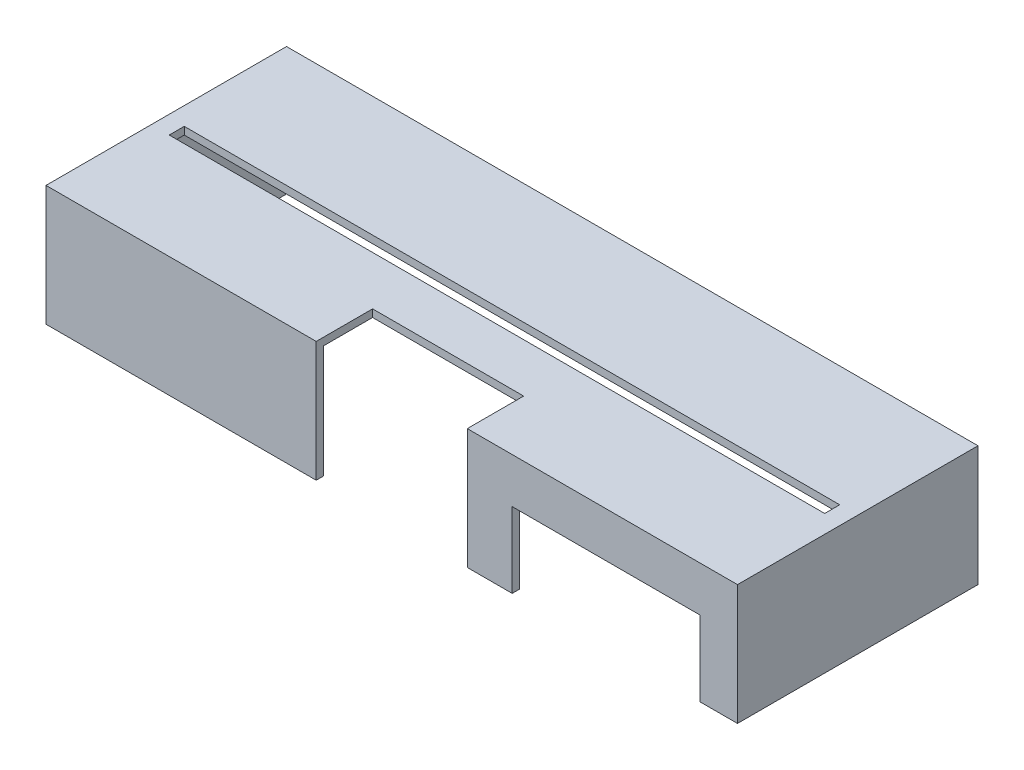
from build123d import *

# Parameters (mm, degrees)
SKETCH1_W                       = 184
SKETCH1_H                       = 64
SKETCH1_W_2                     = 180
SKETCH1_H_2                     = 60
EXTRUDE_THIN1_DEPTH             = 30
SKETCH3_W                       = 184
SKETCH3_H                       = 64
BOSS_EXTRUDE1_DEPTH             = 2
SKETCH4_W                       = 174.419493498
SKETCH4_H                       = 4
CUT_EXTRUDE1_DEPTH              = 5
SKETCH5_W                       = 40.195784268
SKETCH5_H                       = 59.069599678
CUT_EXTRUDE2_DEPTH              = 15
SKETCH6_W                       = 44.195784268
SKETCH6_H                       = 67.776893145
SKETCH6_W_2                     = 40.195784268
SKETCH6_H_2                     = 63.776893145
EXTRUDE_THIN2_DEPTH             = 35
EXTRUDE_THIN2_DIRECTION_2_REACH = 118.55
SKETCH7_W                       = 128.018506196
SKETCH7_H                       = 58.604777903
CUT_EXTRUDE3_DEPTH              = 85
SKETCH8_W                       = 13
SKETCH8_H                       = 30
CUT_EXTRUDE4_DEPTH              = 85
SKETCH9_W                       = 44.195784268
SKETCH9_H                       = 65.776893145
BOSS_EXTRUDE2_DEPTH             = 2
SKETCH13_W                      = 20.06
SKETCH13_H                      = 40.06
CUT_EXTRUDE6_DEPTH              = 10
SKETCH18_R                      = 2.03
CUT_EXTRUDE8_DEPTH              = 10
SKETCH19_W                      = 50
SKETCH19_H                      = 40
CUT_EXTRUDE9_DEPTH              = 10
SKETCH20_R                      = 2.03
CUT_EXTRUDE10_DEPTH             = 10
SKETCH21_W                      = 37
SKETCH21_H                      = 32
CUT_EXTRUDE11_DEPTH             = 217


with BuildPart() as part:
    # Sketch1 → Extrude-Thin1 (new body)
    with BuildSketch(Plane(origin=(0, 0, 0), x_dir=(1, 0, 0), z_dir=(0, 1, 0))):
        Rectangle(SKETCH1_W, SKETCH1_H)
        Rectangle(SKETCH1_W_2, SKETCH1_H_2, mode=Mode.SUBTRACT)
    extrude(amount=EXTRUDE_THIN1_DEPTH)

    # Sketch3 → Boss-Extrude1 (add)
    with BuildSketch(Plane(origin=(0, 30, 0), x_dir=(1, 0, 0), z_dir=(0, 1, 0))):
        Rectangle(SKETCH3_W, SKETCH3_H)
    extrude(amount=BOSS_EXTRUDE1_DEPTH)

    # Sketch4 → Cut-Extrude1 (cut)
    with BuildSketch(Plane(origin=(0, 32, 0), x_dir=(1, 0, 0), z_dir=(0, 1, 0))):
        with Locations((0, -2)):
            Rectangle(SKETCH4_W, SKETCH4_H)
    extrude(amount=-CUT_EXTRUDE1_DEPTH, mode=Mode.SUBTRACT)

    # Sketch5 → Cut-Extrude2 (cut)
    with BuildSketch(Plane.XY.offset(32)):
        with Locations((0, 16)):
            Rectangle(SKETCH5_W, SKETCH5_H)
    extrude(amount=-CUT_EXTRUDE2_DEPTH, mode=Mode.SUBTRACT)

    # Sketch6 → Extrude-Thin2 (add)
    with BuildSketch(Plane.XY.offset(32)):
        with Locations((0, 31.888446573)):
            Rectangle(SKETCH6_W, SKETCH6_H)
        with Locations((0, 31.888446573)):
            Rectangle(SKETCH6_W_2, SKETCH6_H_2, mode=Mode.SUBTRACT)
    extrude(amount=EXTRUDE_THIN2_DEPTH)

    # Extrude-Thin2 direction 2: up to this face of the body (flat: up to its plane)
    extrude_thin2_direction_2_end = Plane(part.part.faces().sort_by_distance((0, 31, 17))[0])
    # Sketch6 → Extrude-Thin2 direction 2 (add, up to the picked face)
    with BuildSketch(Plane.XY.offset(32), mode=Mode.PRIVATE) as extrude_thin2_direction_2_sk1:
        with Locations((0, 31.888446573)):
            Rectangle(SKETCH6_W, SKETCH6_H)
        with Locations((0, 31.888446573)):
            Rectangle(SKETCH6_W_2, SKETCH6_H_2, mode=Mode.SUBTRACT)
    extrude_thin2_direction_2_tool1 = split(extrude(extrude_thin2_direction_2_sk1.sketch, amount=-EXTRUDE_THIN2_DIRECTION_2_REACH, mode=Mode.PRIVATE), bisect_by=extrude_thin2_direction_2_end, keep=Keep.BOTH, mode=Mode.PRIVATE)
    add(extrude_thin2_direction_2_tool1.solids().sort_by(Axis((0, -1.190866, 32), (0, 0, -1)))[0])

    # Sketch7 → Cut-Extrude3 (cut)
    with BuildSketch(Plane.XZ):
        with Locations((2.364457898, 44.353486129)):
            Rectangle(SKETCH7_W, SKETCH7_H)
    extrude(amount=CUT_EXTRUDE3_DEPTH, mode=Mode.SUBTRACT)

    # Sketch8 → Cut-Extrude4 (cut)
    with BuildSketch(Plane.ZY.offset(22.097892134)):
        with Locations((23.5, 15)):
            Rectangle(SKETCH8_W, SKETCH8_H)
    extrude(amount=-CUT_EXTRUDE4_DEPTH, mode=Mode.SUBTRACT)

    # Sketch9 → Boss-Extrude2 (add)
    with BuildSketch(Plane.XY.offset(67)):
        with Locations((0, 32.888446573)):
            Rectangle(SKETCH9_W, SKETCH9_H)
    extrude(amount=BOSS_EXTRUDE2_DEPTH)

    # Sketch13 → Cut-Extrude6 (cut)
    with BuildSketch(Plane.XY.offset(69)):
        with Locations((0, 30.776893145)):
            Rectangle(SKETCH13_W, SKETCH13_H)
    extrude(amount=-CUT_EXTRUDE6_DEPTH, mode=Mode.SUBTRACT)

    # Sketch18 → Cut-Extrude8 (cut)
    with BuildSketch(Plane.XY.offset(69)):
        with Locations((-5, 6.246893145)):
            Circle(SKETCH18_R)
        with Locations((5, 6.246893145)):
            Circle(SKETCH18_R)
    extrude(amount=-CUT_EXTRUDE8_DEPTH, mode=Mode.SUBTRACT)

    # Sketch19 → Cut-Extrude9 (cut)
    with BuildSketch(Plane.XY.offset(32)):
        with Locations((57.048946067, 0)):
            Rectangle(SKETCH19_W, SKETCH19_H)
    extrude(amount=-CUT_EXTRUDE9_DEPTH, mode=Mode.SUBTRACT)

    # Sketch20 → Cut-Extrude10 (cut)
    with BuildSketch(Plane.XY.offset(69)):
        with Locations((-5, 55.306893145)):
            Circle(SKETCH20_R)
        with Locations((5, 55.306893145)):
            Circle(SKETCH20_R)
    extrude(amount=-CUT_EXTRUDE10_DEPTH, mode=Mode.SUBTRACT)

    # Sketch21 → Cut-Extrude11 (cut)
    with BuildSketch(Plane.ZY.offset(22.097892134)):
        Polygon((72.732917278, 32), (69, 32), (69, 0), (32, 0), (32, -6.74330067), (76.348445097, -6.74330067), (76.348445097, 32), align=None)
        with Locations((50.5, 16)):
            Rectangle(SKETCH21_W, SKETCH21_H)
        Polygon((17, 65.776893145), (17, 32), (32, 32), (69, 32), (69, 65.776893145), align=None)
    extrude(amount=-CUT_EXTRUDE11_DEPTH, mode=Mode.SUBTRACT)


solid = part.part
